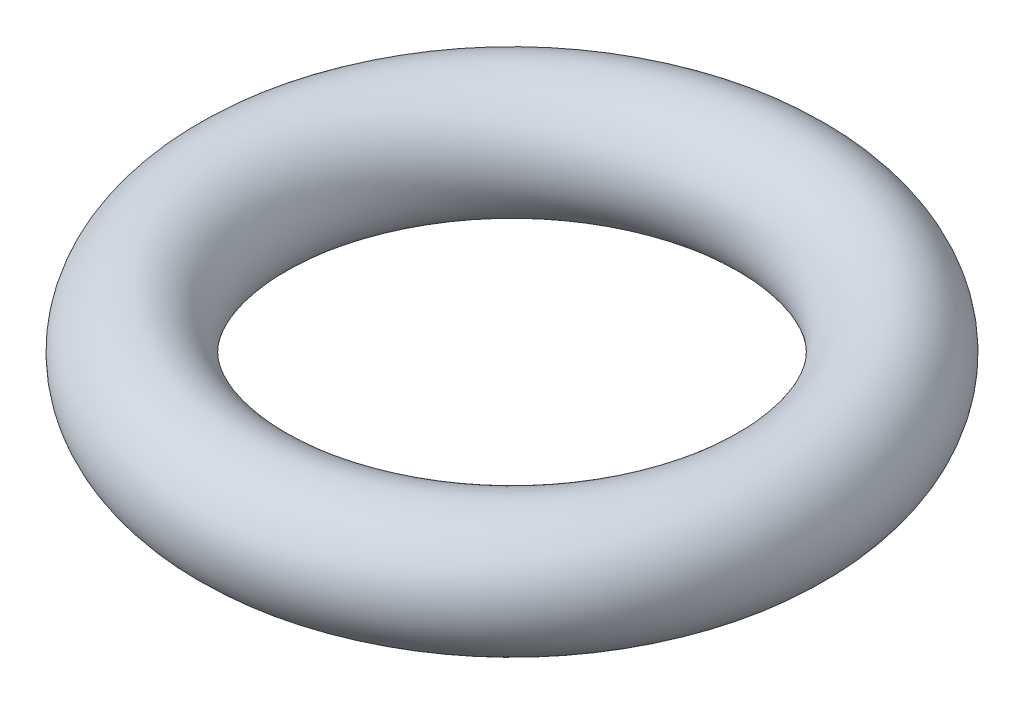
from build123d import *

# Parameters (mm, degrees)
SKETCH1_R = 0.4445


with BuildPart() as part:
    # Sketch1 → Revolve1 (revolve)
    with BuildSketch(Plane.XY, mode=Mode.PRIVATE) as revolve1_sk:
        with Locations((1.9685, 0)):
            Circle(SKETCH1_R)
    revolve(revolve1_sk.sketch.rotate(Axis((0, 24.278755098, 0), (0, -1, 0)), 90), axis=Axis((0, 24.278755098, 0), (0, -1, 0)))


solid = part.part
